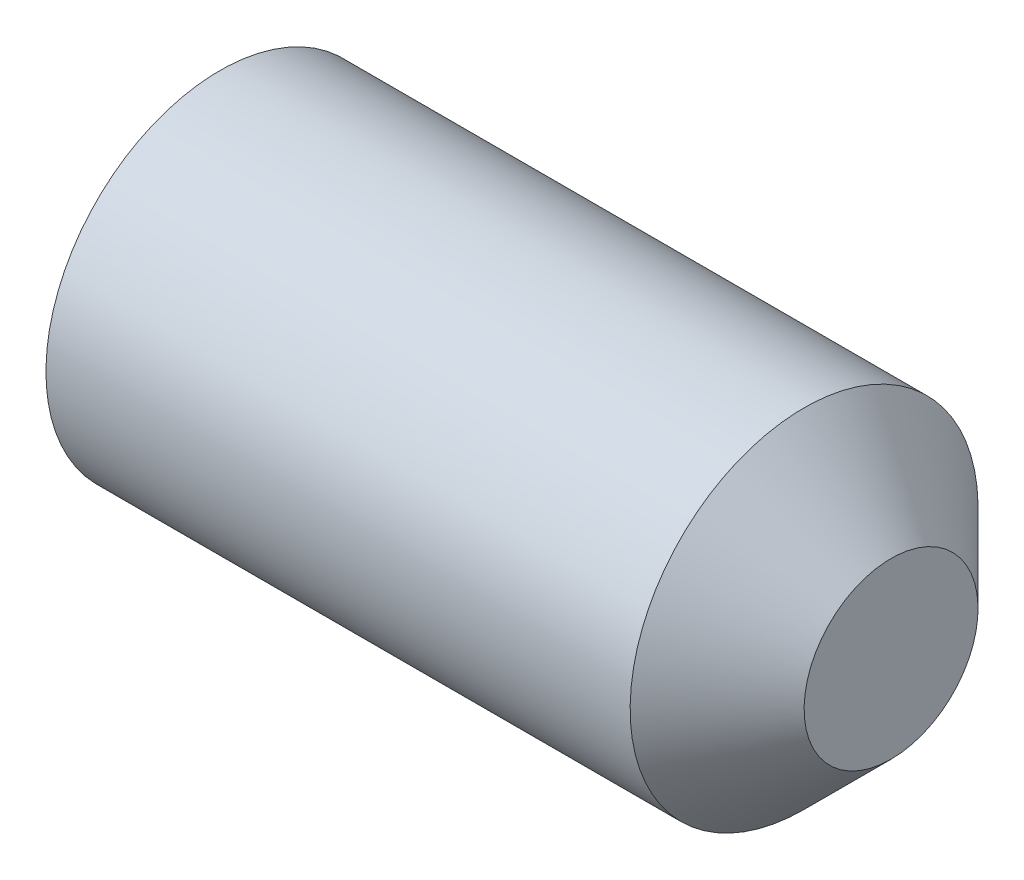
from build123d import *

# Parameters (mm, degrees)
CUT_EXTRUDE1_DEPTH = 1.7


with BuildPart() as part:
    # Sketch1 → Revolve1 (revolve)
    with BuildSketch(Plane.XY):
        Polygon((4, 0), (4, -0.5), (3.5, -1), (0.141739491, -1), (0, -0.7545), (0, -0.519615242), (0.3, 0), align=None)
    revolve(axis=Axis((0.3, 0, 0), (1, 0, 0)))

    # Sketch2 → Cut-Extrude1 (cut)
    with BuildSketch(Plane(origin=(0, 0, 0), x_dir=(0, 0, -1), z_dir=(1, 0, 0))):
        Polygon((-0.519615242, 0), (-0.259807621, -0.45), (0.259807621, -0.45), (0.519615242, 0), (0.259807621, 0.45), (-0.259807621, 0.45), align=None)
    extrude(amount=CUT_EXTRUDE1_DEPTH, mode=Mode.SUBTRACT)


solid = part.part
